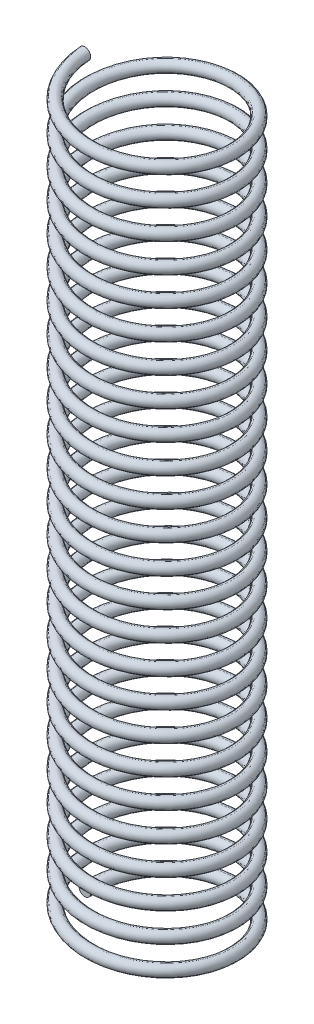
from build123d import *

# Parameters (mm, degrees)
SWEEP2_PITCH       = 0.637633333
SWEEP2_HEIGHT      = 15.940833333
SWEEP2_RADIUS      = 1.5875
SWEEP2_START_ANGLE = -90
SKETCH13_R         = 0.127


with BuildPart() as part:
    # Sweep2: sweep along a helix
    with BuildLine() as sweep2_path:
        add(Helix(SWEEP2_PITCH, SWEEP2_HEIGHT, SWEEP2_RADIUS, center=(0, 0, 0), direction=(0, 1, 0), lefthand=True, mode=Mode.PRIVATE).rotate(Axis((0, 0, 0), (0, 1, 0)), SWEEP2_START_ANGLE))
    # Sketch13 → Sweep2 (sweep)
    with BuildSketch(Plane.XY):
        with Locations((-1.5875, 0)):
            Circle(SKETCH13_R)
    sweep(path=sweep2_path.line, is_frenet=True)


solid = part.part
